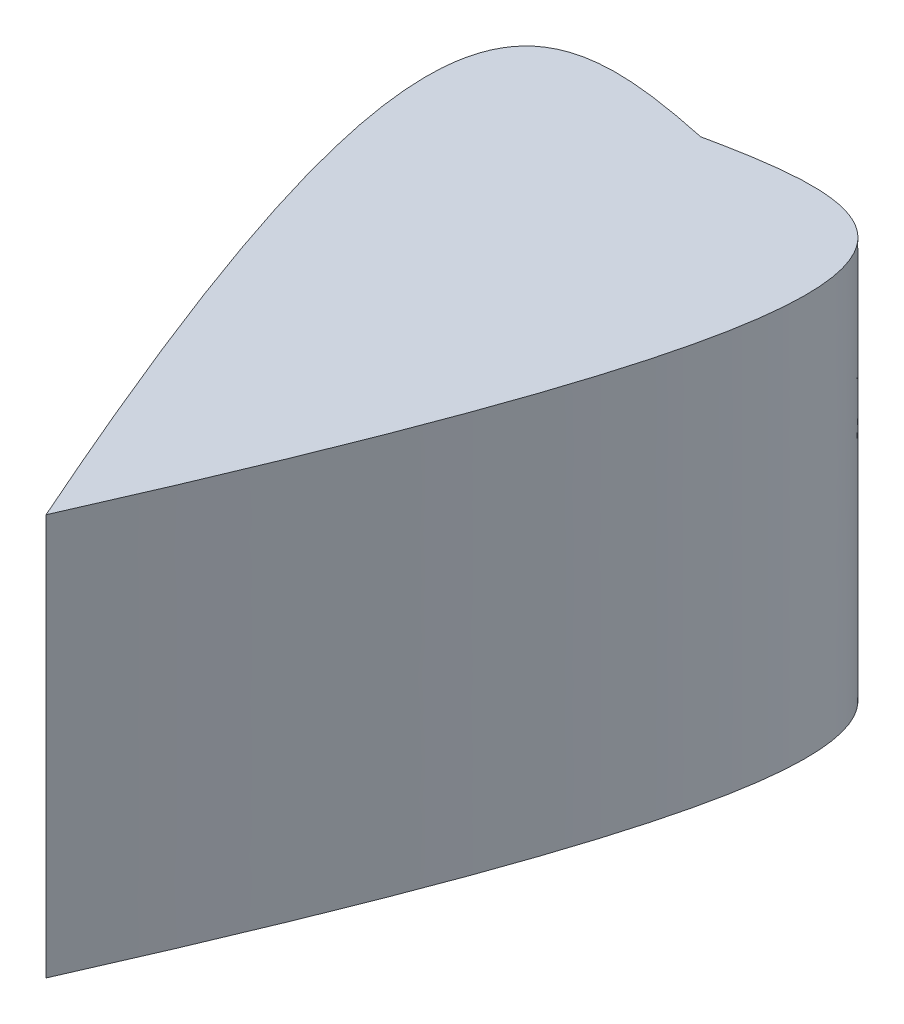
from build123d import *

# Parameters (mm, degrees)
BOSS_EXTRUDE1_DEPTH = 400


with BuildPart() as part:
    # Sketch3 → Boss-Extrude1 (new body)
    with BuildSketch(Plane(origin=(0, 607.769055783, 0), x_dir=(1, 0, 0), z_dir=(0, 1, 0))):
        with BuildLine():
            add(Edge.make_bspline(
                [(127.864614934, -1926.660568763), (330.003894507, -1883.776372425), (425.190623096, -1907.410053273), (127.864614934, -2579.349496173)],
                knots=[0, 0, 0, 0, 1, 1, 1, 1], degree=3))
            add(Edge.make_bspline(
                [(127.864614934, -1926.660568763), (-74.27466464, -1883.776372425), (-169.461393229, -1907.410053273), (127.864614934, -2579.349496173)],
                knots=[0, 0, 0, 0, 1, 1, 1, 1], degree=3))
        make_face()
    extrude(amount=BOSS_EXTRUDE1_DEPTH)


solid = part.part
